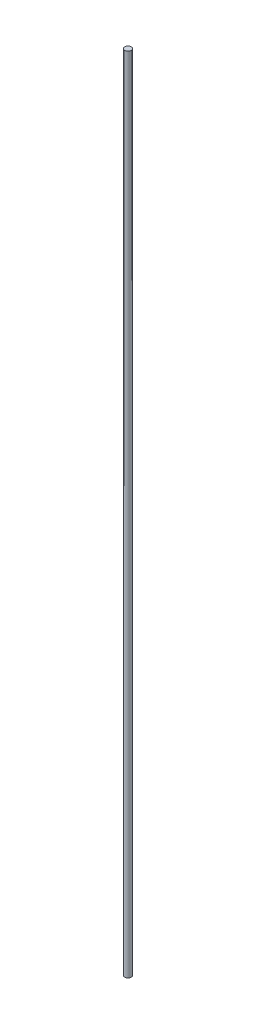
from build123d import *

# Parameters (mm, degrees)
SKETCH_1_R      = 2
EXTRUDE_1_DEPTH = 500


with BuildPart() as part:
    # 草图1 → 凸台-拉伸1 (new body)
    with BuildSketch(Plane(origin=(0, 0, 0), x_dir=(1, 0, 0), z_dir=(0, 1, 0))):
        with Locations(Location((0, 0, 0), (0, 0, 270))):
            Circle(SKETCH_1_R)
    extrude(amount=EXTRUDE_1_DEPTH)


solid = part.part
